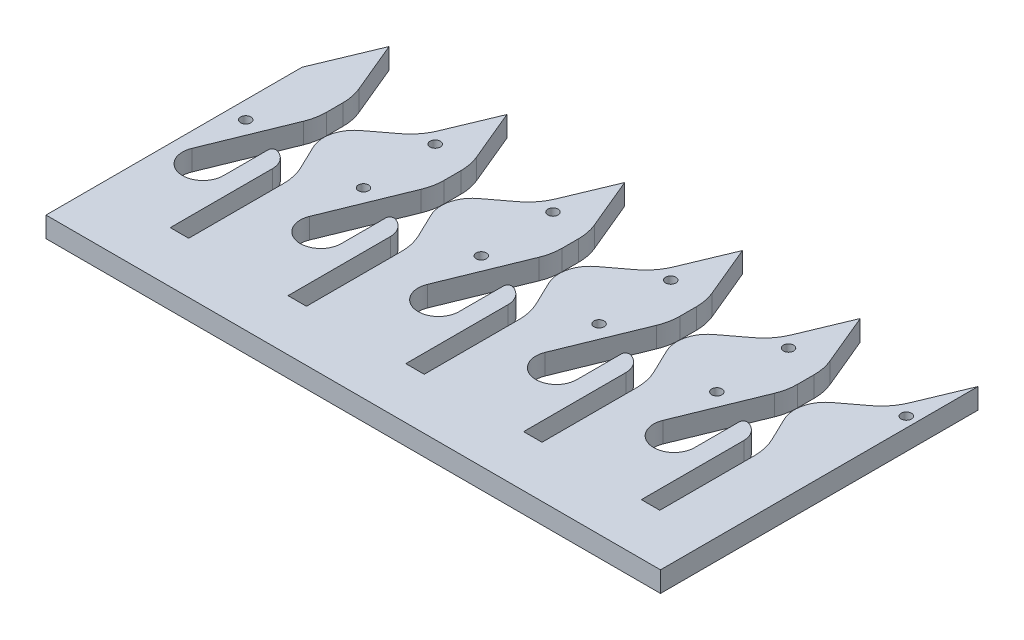
from build123d import *

# Parameters (mm, degrees)
SKETCH1_R           = 2.5
BOSS_EXTRUDE1_DEPTH = 10
FILLET1_R           = 25
FILLET2_R           = 2


with BuildPart() as part:
    # Sketch1 → Boss-Extrude1 (new body)
    with BuildSketch(Plane(origin=(0, 0, 0), x_dir=(1, 0, 0), z_dir=(0, 1, 0))):
        with BuildLine():
            Line((0, 0), (-300, 0))
            Line((-300, 0), (-300, 125))
            Line((-300, 125), (-287.5, 155))
            Line((-287.5, 155), (-275, 125))
            Line((-275, 125), (-275, 107))
            Line((-275, 107), (-292.60586559, 63.771946566))
            ThreePointArc((-292.60586559, 63.771946566), (-285.266321562, 50.186402284), (-273.344525562, 60))
            Line((-273.344525562, 60), (-273.344525562, 84))
            ThreePointArc((-273.344525562, 84), (-266.980564532, 81.363961031), (-264.344525562, 75))
            Line((-264.344525562, 75), (-264.344525562, 25))
            Line((-264.344525562, 25), (-255.344525562, 25))
            Line((-255.344525562, 25), (-255.344525563, 77))
            Line((-255.344525563, 77), (-263.518505835, 94))
            ThreePointArc((-263.518505835, 94), (-264.580199309, 104.023888208), (-259.057764575, 112.456458543))
            Line((-259.057764575, 112.456458543), (-242.5, 125))
            Line((-242.5, 125), (-230, 155))
            Line((-230, 155), (-217.5, 125))
            Line((-217.5, 125), (-217.5, 107))
            Line((-217.5, 107), (-235.10586559, 63.771946566))
            ThreePointArc((-235.10586559, 63.771946566), (-227.766321562, 50.186402284), (-215.844525562, 60))
            Line((-215.844525562, 60), (-215.844525562, 84))
            ThreePointArc((-215.844525562, 84), (-209.480564532, 81.363961031), (-206.844525562, 75))
            Line((-206.844525562, 75), (-206.844525562, 25))
            Line((-206.844525562, 25), (-197.844525562, 25))
            Line((-197.844525562, 25), (-197.844525563, 77))
            Line((-197.844525563, 77), (-206.018505835, 94))
            ThreePointArc((-206.018505835, 94), (-207.080199309, 104.023888208), (-201.557764575, 112.456458543))
            Line((-201.557764575, 112.456458543), (-185, 125))
            Line((-185, 125), (-172.5, 155))
            Line((-172.5, 155), (-160, 125))
            Line((-160, 125), (-160, 107))
            Line((-160, 107), (-177.60586559, 63.771946566))
            ThreePointArc((-177.60586559, 63.771946566), (-170.266321562, 50.186402284), (-158.344525563, 60))
            Line((-158.344525563, 60), (-158.344525563, 84))
            ThreePointArc((-158.344525563, 84), (-151.980564532, 81.363961031), (-149.344525563, 75))
            Line((-149.344525563, 75), (-149.344525563, 25))
            Line((-149.344525563, 25), (-140.344525563, 25))
            Line((-140.344525563, 25), (-140.344525563, 77))
            Line((-140.344525563, 77), (-148.518505835, 94))
            ThreePointArc((-148.518505835, 94), (-149.580199309, 104.023888208), (-144.057764575, 112.456458543))
            Line((-144.057764575, 112.456458543), (-127.5, 125))
            Line((-127.5, 125), (-115, 155))
            Line((-115, 155), (-102.5, 125))
            Line((-102.5, 125), (-102.5, 107))
            Line((-102.5, 107), (-120.10586559, 63.771946566))
            ThreePointArc((-120.10586559, 63.771946566), (-112.766321562, 50.186402284), (-100.844525563, 60))
            Line((-100.844525563, 60), (-100.844525563, 84))
            ThreePointArc((-100.844525563, 84), (-94.480564532, 81.363961031), (-91.844525563, 75))
            Line((-91.844525563, 75), (-91.844525563, 25))
            Line((-91.844525563, 25), (-82.844525563, 25))
            Line((-82.844525563, 25), (-82.844525563, 77))
            Line((-82.844525563, 77), (-91.018505835, 94))
            ThreePointArc((-91.018505835, 94), (-92.080199309, 104.023888208), (-86.557764575, 112.456458543))
            Line((-86.557764575, 112.456458543), (-70, 125))
            Line((-70, 125), (-57.5, 155))
            Line((-57.5, 155), (-45, 125))
            Line((-45, 125), (-45, 107))
            Line((-45, 107), (-62.60586559, 63.771946566))
            ThreePointArc((-62.60586559, 63.771946566), (-55.266321562, 50.186402284), (-43.344525562, 60))
            Line((-43.344525562, 60), (-43.344525562, 84))
            ThreePointArc((-43.344525562, 84), (-36.980564532, 81.363961031), (-34.344525562, 75))
            Line((-34.344525562, 75), (-34.344525562, 25))
            Line((-34.344525562, 25), (-25.344525562, 25))
            Line((-25.344525562, 25), (-25.344525563, 77))
            Line((-25.344525563, 77), (-33.518505835, 94))
            ThreePointArc((-33.518505835, 94), (-34.580199309, 104.023888208), (-29.057764575, 112.456458543))
            Line((-29.057764575, 112.456458543), (-12.5, 125))
            Line((-12.5, 125), (0, 155))
            Line((0, 155), (0, 0))
        make_face()
        with Locations(Location((-5, 125, 0), (0, 0, 270))):
            Circle(SKETCH1_R, mode=Mode.SUBTRACT)
        with Locations(Location((-61.5, 89, 0), (0, 0, 270))):
            Circle(SKETCH1_R, mode=Mode.SUBTRACT)
        with Locations(Location((-62.5, 125, 0), (0, 0, 270))):
            Circle(SKETCH1_R, mode=Mode.SUBTRACT)
        with Locations(Location((-119, 89, 0), (0, 0, 270))):
            Circle(SKETCH1_R, mode=Mode.SUBTRACT)
        with Locations(Location((-120, 125, 0), (0, 0, 270))):
            Circle(SKETCH1_R, mode=Mode.SUBTRACT)
        with Locations(Location((-176.5, 89, 0), (0, 0, 270))):
            Circle(SKETCH1_R, mode=Mode.SUBTRACT)
        with Locations(Location((-177.5, 125, 0), (0, 0, 270))):
            Circle(SKETCH1_R, mode=Mode.SUBTRACT)
        with Locations(Location((-234, 89, 0), (0, 0, 270))):
            Circle(SKETCH1_R, mode=Mode.SUBTRACT)
        with Locations(Location((-235, 125, 0), (0, 0, 270))):
            Circle(SKETCH1_R, mode=Mode.SUBTRACT)
        with Locations(Location((-291.5, 89, 0), (0, 0, 270))):
            Circle(SKETCH1_R, mode=Mode.SUBTRACT)
    extrude(amount=BOSS_EXTRUDE1_DEPTH)

    # Fillet1
    fillet1_edges = [part.edges().sort_by_distance(p)[0] for p in [
        (-275, 5, -125),
        (-275, 5, -107),
        (-255.344525563, 5, -77),
        (-242.5, 5, -125),
        (-217.5, 5, -125),
        (-217.5, 5, -107),
        (-197.844525563, 5, -77),
        (-185, 5, -125),
        (-160, 5, -125),
        (-160, 5, -107),
        (-140.344525563, 5, -77),
        (-127.5, 5, -125),
        (-102.5, 5, -125),
        (-102.5, 5, -107),
        (-82.844525563, 5, -77),
        (-70, 5, -125),
        (-45, 5, -125),
        (-45, 5, -107),
        (-25.344525563, 5, -77),
        (-12.5, 5, -125),
    ]]
    fillet(fillet1_edges, radius=FILLET1_R)

    # Fillet2
    fillet2_edges = [part.edges().sort_by_distance(p)[0] for p in [
        (-273.344525562, 5, -84),
        (-215.844525562, 5, -84),
        (-158.344525563, 5, -84),
        (-100.844525563, 5, -84),
        (-43.344525562, 5, -84),
    ]]
    fillet(fillet2_edges, radius=FILLET2_R)


solid = part.part
